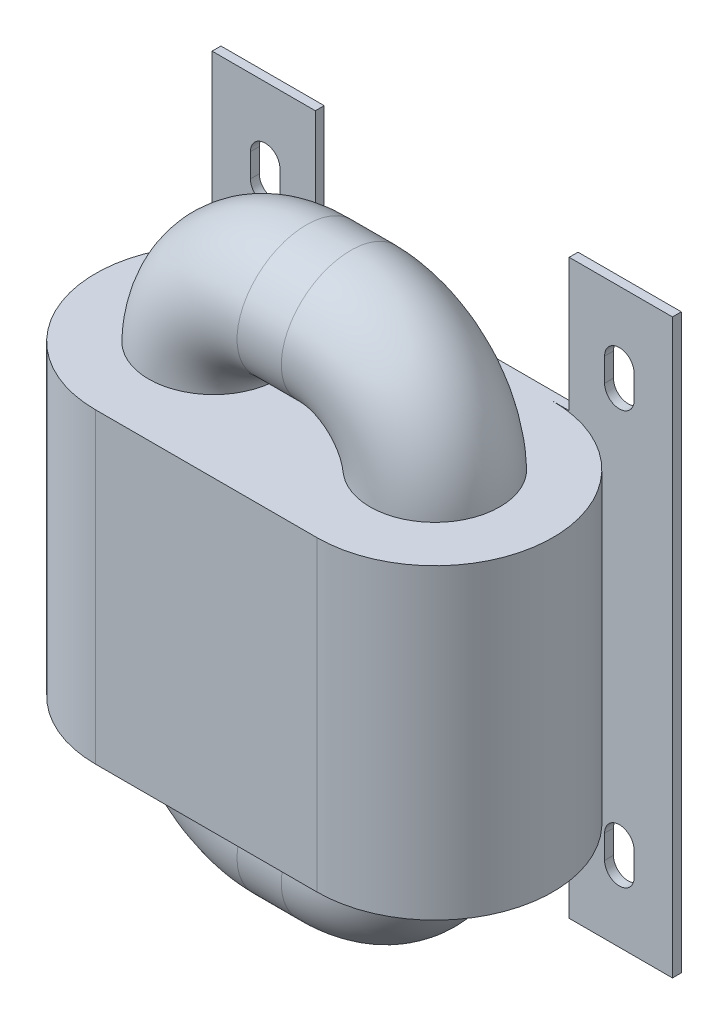
from build123d import *

# Parameters (mm, degrees)
EXTRUDE_1_DEPTH     = 52
EXTRUDE_2_DEPTH     = 1.5
SKETCH_4_R          = 11
CUT_EXTRUDE_1_DEPTH = 1.5


with BuildPart() as part:
    # 草图1 → 拉伸1 (new body)
    with BuildSketch(Plane(origin=(0, 0, 0), x_dir=(1, 0, 0), z_dir=(0, 1, 0))):
        with BuildLine():
            Line((-18.75, 20), (18.75, 20))
            ThreePointArc((18.75, 20), (38.75, 0), (18.75, -20))
            Line((18.75, -20), (-18.75, -20))
            ThreePointArc((-18.75, -20), (-38.75, 0), (-18.75, 20))
        make_face()
    extrude(amount=EXTRUDE_1_DEPTH)

    # 草图2 → 拉伸2 (add)
    with BuildSketch(Plane(origin=(0, 0, -20), x_dir=(-1, 0, 0), z_dir=(0, 0, -1))):
        Polygon((39, 74.5), (39, -22.5), (21.5, -22.5), (21.5, 0), (-21.5, 0), (-21.5, -22.5), (-39, -22.5), (-39, 74.5), (-21.5, 74.5), (-21.5, 52), (21.5, 52), (21.5, 74.5), align=None)
    extrude(amount=EXTRUDE_2_DEPTH)

    # 扫描4: sweep along a path in 草图3
    with BuildLine(Plane.XY) as sweep_4_path:
        Line((18.75, 51), (18.75, 5))
        ThreePointArc((18.75, 5), (14.356601718, -5.606601718), (3.75, -10))
        Line((3.75, -10), (-3.75, -10))
        ThreePointArc((-3.75, -10), (-14.356601718, -5.606601718), (-18.75, 5))
        Line((-18.75, 5), (-18.75, 51))
        ThreePointArc((-18.75, 51), (-14.356601718, 61.606601718), (-3.75, 66))
        Line((-3.75, 66), (3.75, 66))
        ThreePointArc((3.75, 66), (14.356601718, 61.606601718), (18.75, 51))
    # 草图4 → 扫描4 (sweep)
    with BuildSketch(Plane(origin=(0, 52, 0), x_dir=(-1, 0, 0), z_dir=(0, 1, 0))):
        with Locations((-18.75, 0)):
            Circle(SKETCH_4_R)
    sweep(path=sweep_4_path.line)

    # 草图6 → 切除-拉伸1 (cut)
    with BuildSketch(Plane(origin=(0, 0, -21.5), x_dir=(-1, 0, 0), z_dir=(0, 0, -1))):
        with BuildLine():
            Line((-32.5, 63), (-32.5, 59))
            ThreePointArc((-32.5, 59), (-30, 56.5), (-27.5, 59))
            Line((-27.5, 59), (-27.5, 63))
            ThreePointArc((-27.5, 63), (-30, 65.5), (-32.5, 63))
        make_face()
        with BuildLine():
            Line((32.5, 63), (32.5, 59))
            ThreePointArc((32.5, 59), (30, 56.5), (27.5, 59))
            Line((27.5, 59), (27.5, 63))
            ThreePointArc((27.5, 63), (30, 65.5), (32.5, 63))
        make_face()
        with BuildLine():
            Line((32.5, -11), (32.5, -7))
            ThreePointArc((32.5, -7), (30, -4.5), (27.5, -7))
            Line((27.5, -7), (27.5, -11))
            ThreePointArc((27.5, -11), (30, -13.5), (32.5, -11))
        make_face()
        with BuildLine():
            Line((-27.5, -11), (-27.5, -7))
            ThreePointArc((-27.5, -7), (-30, -4.5), (-32.5, -7))
            Line((-32.5, -7), (-32.5, -11))
            ThreePointArc((-32.5, -11), (-30, -13.5), (-27.5, -11))
        make_face()
    extrude(amount=-CUT_EXTRUDE_1_DEPTH, mode=Mode.SUBTRACT)


solid = part.part
